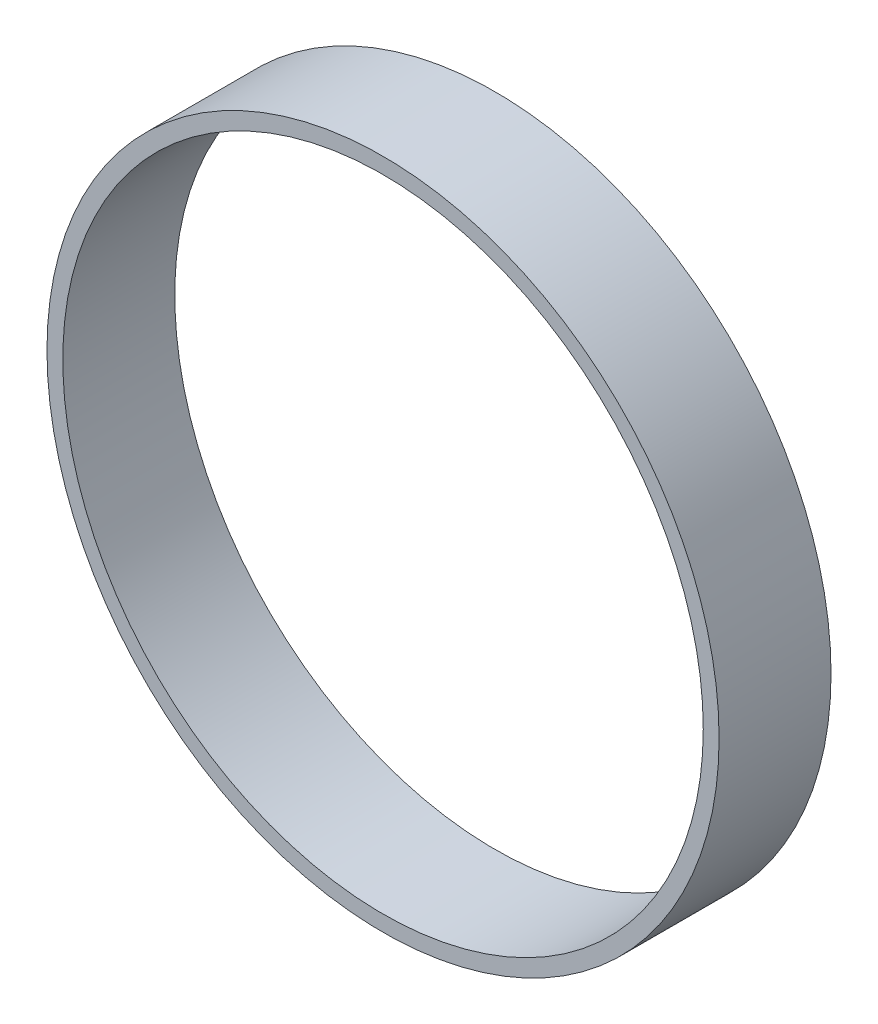
from build123d import *

# Parameters (mm, degrees)
SKETCH1_R      = 15.6337
SKETCH1_R_2    = 14.8971
EXTRUDE1_DEPTH = 5.207


with BuildPart() as part:
    # Sketch1 → Extrude1 (new body)
    with BuildSketch(Plane.XY):
        Circle(SKETCH1_R)
        Circle(SKETCH1_R_2, mode=Mode.SUBTRACT)
    extrude(amount=EXTRUDE1_DEPTH)


solid = part.part
